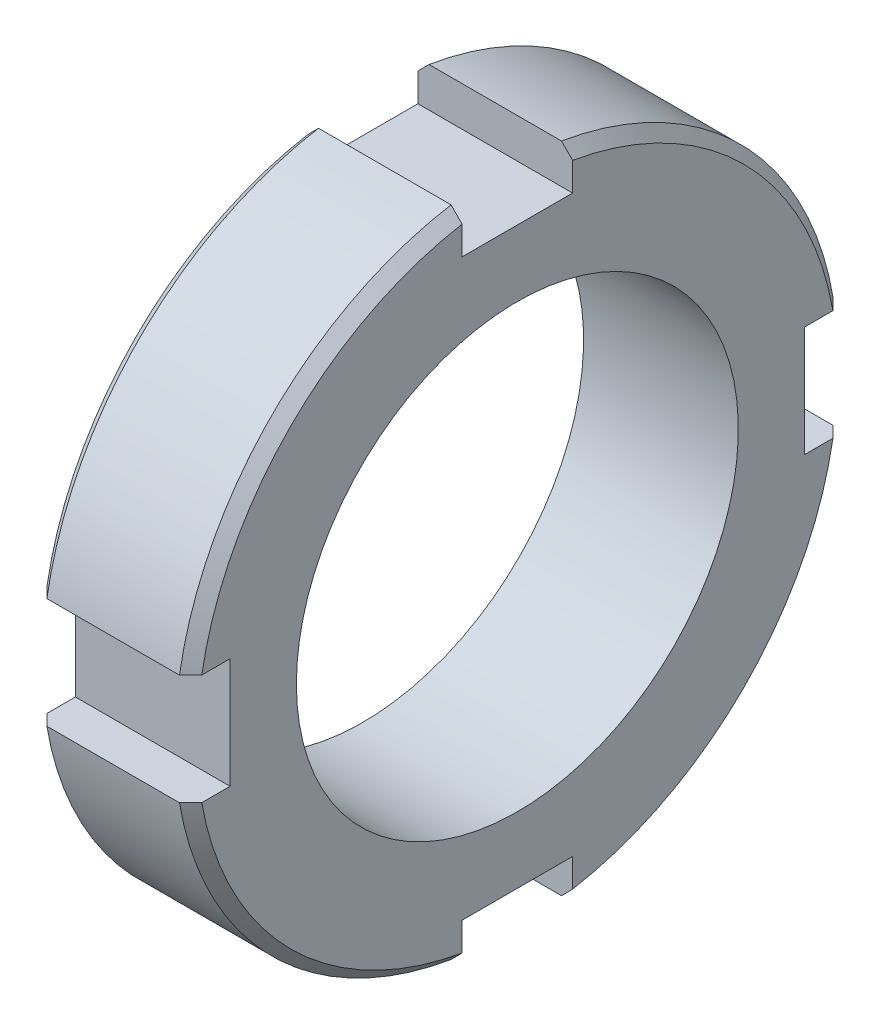
from build123d import *

# Parameters (mm, degrees)
SKETCH_2_W       = 4
SKETCH_2_H       = 5
SKETCH_2_W_2     = 5
SKETCH_2_H_2     = 4
F_02_SLOTS_DEPTH = 8


with BuildPart() as part:
    # 草图1 → 01_RING (revolve)
    with BuildSketch(Plane.XY, mode=Mode.PRIVATE) as f_01_ring_sk:
        Polygon((0, 10), (0, 14.5), (0.5, 15), (6.5, 15), (7, 14.5), (7, 10), align=None)
    revolve(f_01_ring_sk.sketch.rotate(Axis((-5, 0, 0), (1, 0, 0)), 90), axis=Axis((-5, 0, 0), (1, 0, 0)))

    # 草图2 → 02_SLOTS (cut)
    with BuildSketch(Plane(origin=(-0.5, 0, 0), x_dir=(0, 0, -1), z_dir=(1, 0, 0))):
        with Locations((15, 0)):
            Rectangle(SKETCH_2_W, SKETCH_2_H)
        with Locations((-15, 0)):
            Rectangle(SKETCH_2_W, SKETCH_2_H)
        with Locations((0, 15)):
            Rectangle(SKETCH_2_W_2, SKETCH_2_H_2)
        with Locations((0, -15)):
            Rectangle(SKETCH_2_W_2, SKETCH_2_H_2)
    extrude(amount=F_02_SLOTS_DEPTH, mode=Mode.SUBTRACT)


solid = part.part
